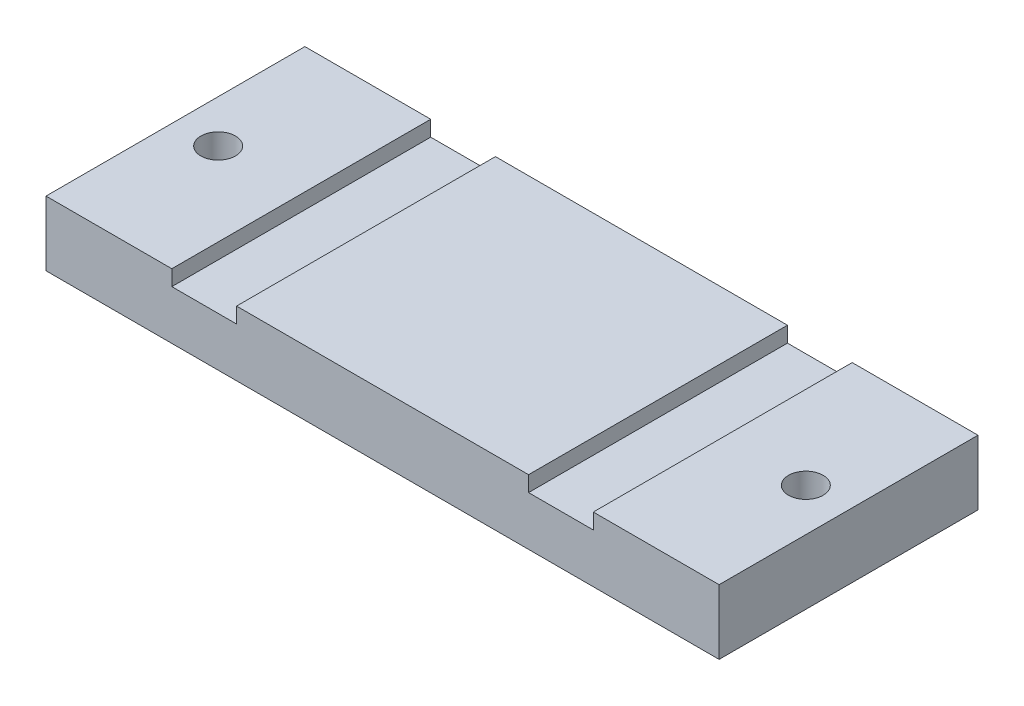
from build123d import *

# Parameters (mm, degrees)
SKETCH1_W            = 66.04
SKETCH1_H            = 25.4
BOSS_EXTRUDE1_DEPTH  = 6.35
M3_CLEARANCE_HOLE1_D = 3.4
SKETCH5_W            = 6.35
SKETCH5_H            = 1.524
CUT_EXTRUDE1_DEPTH   = 72.040580656


with BuildPart() as part:
    # Sketch1 → Boss-Extrude1 (new body)
    with BuildSketch(Plane(origin=(0, 0, 0), x_dir=(1, 0, 0), z_dir=(0, 1, 0))):
        with Locations((33.02, 12.7)):
            Rectangle(SKETCH1_W, SKETCH1_H)
    extrude(amount=BOSS_EXTRUDE1_DEPTH)

    # M3 Clearance Hole1 (through all)
    with Locations(Plane(origin=(0, 6.35, 0), x_dir=(1, 0, 0), z_dir=(0, 1, 0))):
        with Locations((4.191, 12.7), (61.849, 12.7)):
            Hole(M3_CLEARANCE_HOLE1_D / 2)

    # Sketch5 → Cut-Extrude1 (cut, through all)
    with BuildSketch(Plane.XY):
        with Locations((50.52, 5.588)):
            Rectangle(SKETCH5_W, SKETCH5_H)
        with Locations((15.52, 5.588)):
            Rectangle(SKETCH5_W, SKETCH5_H)
    extrude(amount=-CUT_EXTRUDE1_DEPTH, mode=Mode.SUBTRACT)


solid = part.part
